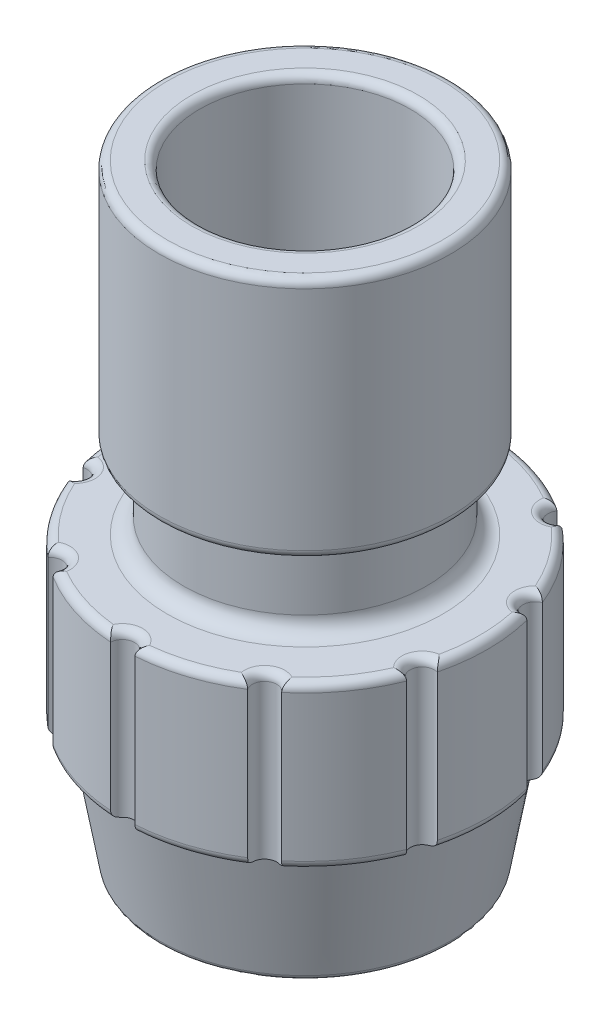
from build123d import *

# Parameters (mm, degrees)
SKETCH_1_R               = 17.9
SKETCH_1_R_2             = 16
EXTRUDE_1_DEPTH          = 15
EXTRUDE_1_DRAFT          = -10
SKETCH_2_R               = 22.544904711
EXTRUDE_1_2_DEPTH        = 20
FILLET_1_R               = 0.7
FILLET_2_R               = 1
SKETCH_3_R               = 1.5
CUT_EXTRUDE_1_DEPTH      = 48.344962317
PATTERN_CIRCULAR_1_COUNT = 10
SKETCH_4_R               = 15
EXTRUDE_2_DEPTH          = 10
FILLET_3_R               = 2
SKETCH_5_R               = 18
EXTRUDE_3_DEPTH          = 30
SKETCH_6_R               = 13
CUT_EXTRUDE_2_DEPTH      = 82.481887287
FILLET_4_R               = 1
FILLET_5_R               = 1
FILLET_6_R               = 1


with BuildPart() as part:
    # Эскиз1 → Extrude 1 (with draft: the straight prism first)
    with BuildSketch(Plane(origin=(0, 0, 0), x_dir=(1, 0, 0), z_dir=(0, 1, 0))):
        Circle(SKETCH_1_R)
        Circle(SKETCH_1_R_2, mode=Mode.SUBTRACT)
    extrude(amount=EXTRUDE_1_DEPTH)
    # Extrude 1: the draft: its side faces are tilted about the plane it starts from
    extrude_1_sides = [part.faces().sort_by_distance(p)[0] for p in [
        (-17.9, 7.5, 0),
        (-16, 7.5, 0),
    ]]
    draft(extrude_1_sides, Plane(origin=(0, 0, 0), x_dir=(1, 0, 0), z_dir=(0, 1, 0)), EXTRUDE_1_DRAFT)

    # Эскиз2 → Extrude 1 2 (add)
    with BuildSketch(Plane(origin=(0, 15, 0), x_dir=(1, 0, 0), z_dir=(0, 1, 0))):
        Circle(SKETCH_2_R)
    extrude(amount=EXTRUDE_1_2_DEPTH)

    # Скругление1
    fillet_1_edges = [part.edges().sort_by_distance(p)[0] for p in [
        (-16, 0, 0),
        (-17.9, 0, 0),
    ]]
    fillet(fillet_1_edges, radius=FILLET_1_R)

    # Скругление2
    fillet_2_edges = [part.edges().sort_by_distance(p)[0] for p in [
        (-22.544904711, 15, 0),
    ]]
    fillet(fillet_2_edges, radius=FILLET_2_R)

    # Эскиз3 → Вырез-Вытянуть1 (cut, through all)
    with BuildSketch(Plane(origin=(0, 35, 0), x_dir=(1, 0, 0), z_dir=(0, 1, 0))):
        with Locations((0, 22.544904711)):
            Circle(SKETCH_3_R)
    cut_extrude_1 = extrude(amount=-CUT_EXTRUDE_1_DEPTH, mode=Mode.SUBTRACT)

    # Круговой массив1: Вырез-Вытянуть1 ×10 about axis
    pattern_circular_1_axis = Axis((0, 35, 0), (0, -1, 0))
    for i in range(1, PATTERN_CIRCULAR_1_COUNT):
        add(cut_extrude_1.rotate(pattern_circular_1_axis, i * 360 / PATTERN_CIRCULAR_1_COUNT), mode=Mode.SUBTRACT)

    # Эскиз4 → Бобышка-Вытянуть2 (add)
    with BuildSketch(Plane(origin=(0, 35, 0), x_dir=(1, 0, 0), z_dir=(0, 1, 0))):
        Circle(SKETCH_4_R)
    extrude(amount=EXTRUDE_2_DEPTH)

    # Скругление3
    fillet_3_edges = [part.edges().sort_by_distance(p)[0] for p in [
        (-15, 35, 0),
    ]]
    fillet(fillet_3_edges, radius=FILLET_3_R)

    # Эскиз5 → Бобышка-Вытянуть3 (add)
    with BuildSketch(Plane(origin=(0, 45, 0), x_dir=(1, 0, 0), z_dir=(0, 1, 0))):
        Circle(SKETCH_5_R)
    extrude(amount=EXTRUDE_3_DEPTH)

    # Эскиз6 → Вырез-Вытянуть2 (cut, through all)
    with BuildSketch(Plane(origin=(0, 75, 0), x_dir=(1, 0, 0), z_dir=(0, 1, 0))):
        Circle(SKETCH_6_R)
    extrude(amount=-CUT_EXTRUDE_2_DEPTH, mode=Mode.SUBTRACT)

    # Скругление4
    fillet_4_edges = [part.edges().sort_by_distance(p)[0] for p in [
        (-18, 45, 0),
    ]]
    fillet(fillet_4_edges, radius=FILLET_4_R)

    # Скругление5
    fillet_5_edges = [part.edges().sort_by_distance(p)[0] for p in [
        (-18, 75, 0),
        (-13, 75, 0),
    ]]
    fillet(fillet_5_edges, radius=FILLET_5_R)

    # Скругление6
    fillet_6_edges = [part.edges().sort_by_distance(p)[0] for p in [
        (-6.966758692, 35, -21.441478534),
        (0, 35, -21.044904711),
        (6.966758692, 35, -21.441478534),
        (12.369884625, 35, -17.025685556),
        (18.239211047, 35, -13.251562503),
        (20.01489376, 35, -6.503233201),
        (22.544904711, 35, 0),
        (20.01489376, 35, 6.503233201),
        (18.239211047, 35, 13.251562503),
        (12.369884625, 35, 17.025685556),
        (6.966758692, 35, 21.441478534),
        (0, 35, 21.044904711),
        (-6.966758692, 35, 21.441478534),
        (-12.369884625, 35, 17.025685556),
        (-18.239211047, 35, 13.251562503),
        (-20.01489376, 35, 6.503233201),
        (-22.544904711, 35, 0),
        (-20.01489376, 35, -6.503233201),
        (-18.239211047, 35, -13.251562503),
        (-12.369884625, 35, -17.025685556),
    ]]
    fillet(fillet_6_edges, radius=FILLET_6_R)


solid = part.part
